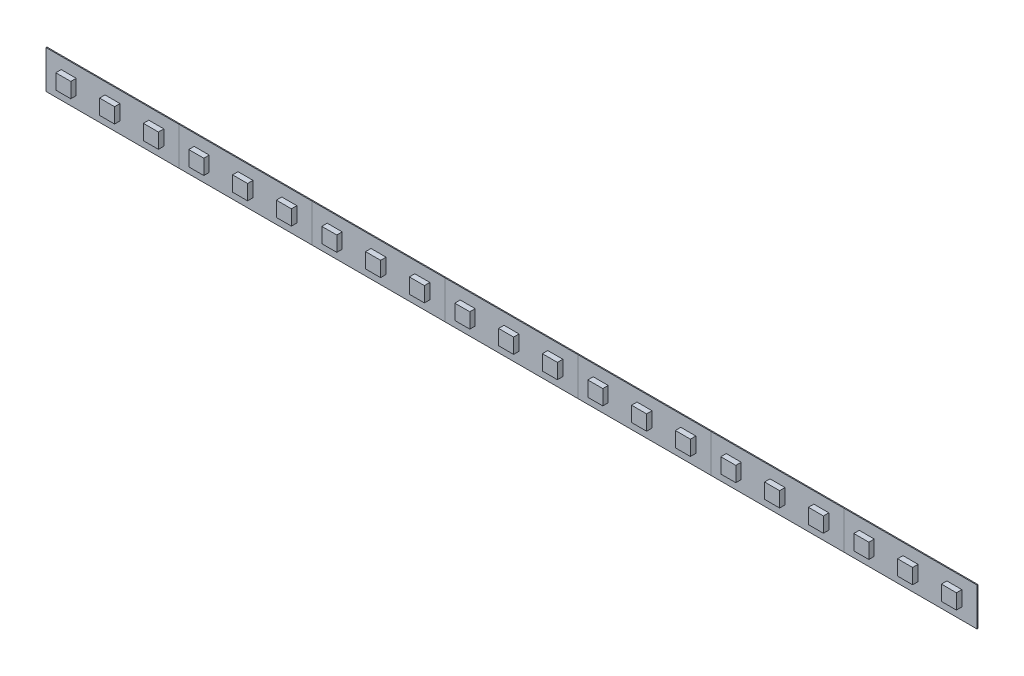
from build123d import *

# Parameters (mm, degrees)
SKETCH1_W           = 41.6
SKETCH1_H           = 11.91
SKETCH1_W_2         = 4.7
SKETCH1_H_2         = 4.7
BOSS_EXTRUDE1_DEPTH = 0.3
SKETCH1_3_W         = 4.7
SKETCH1_3_H         = 4.7
BOSS_EXTRUDE2_DEPTH = 2
LPATTERN1_COUNT     = 7
LPATTERN1_PITCH     = 41.6


with BuildPart() as part:
    # Sketch1 → Boss-Extrude1 (new body)
    with BuildSketch(Plane.XY):
        Rectangle(SKETCH1_W, SKETCH1_H)
        with Locations((-13.7, 0)):
            Rectangle(SKETCH1_W_2, SKETCH1_H_2, mode=Mode.SUBTRACT)
        Rectangle(SKETCH1_W_2, SKETCH1_H_2, mode=Mode.SUBTRACT)
        with Locations((13.7, 0)):
            Rectangle(SKETCH1_W_2, SKETCH1_H_2, mode=Mode.SUBTRACT)
    extrude(amount=BOSS_EXTRUDE1_DEPTH)

    # Sketch1<3> → Boss-Extrude2 (add)
    with BuildSketch(Plane.XY):
        Rectangle(SKETCH1_3_W, SKETCH1_3_H)
        with Locations((-13.7, 0)):
            Rectangle(SKETCH1_3_W, SKETCH1_3_H)
        with Locations((13.7, 0)):
            Rectangle(SKETCH1_3_W, SKETCH1_3_H)
    extrude(amount=BOSS_EXTRUDE2_DEPTH)


with BuildPart() as lpattern1_1:
    # LPattern1: pattern copy
    add(part.part.moved(Location(Vector(-1, 0, 0) * (1 * LPATTERN1_PITCH))))


with BuildPart() as lpattern1_2:
    # LPattern1: pattern copy
    add(part.part.moved(Location(Vector(-1, 0, 0) * (2 * LPATTERN1_PITCH))))


with BuildPart() as lpattern1_3:
    # LPattern1: pattern copy
    add(part.part.moved(Location(Vector(-1, 0, 0) * (3 * LPATTERN1_PITCH))))


with BuildPart() as lpattern1_4:
    # LPattern1: pattern copy
    add(part.part.moved(Location(Vector(-1, 0, 0) * (4 * LPATTERN1_PITCH))))


with BuildPart() as lpattern1_5:
    # LPattern1: pattern copy
    add(part.part.moved(Location(Vector(-1, 0, 0) * (5 * LPATTERN1_PITCH))))


with BuildPart() as lpattern1_6:
    # LPattern1: pattern copy
    add(part.part.moved(Location(Vector(-1, 0, 0) * (6 * LPATTERN1_PITCH))))


solid = Compound([part.part, lpattern1_1.part, lpattern1_2.part, lpattern1_3.part, lpattern1_4.part, lpattern1_5.part, lpattern1_6.part])
